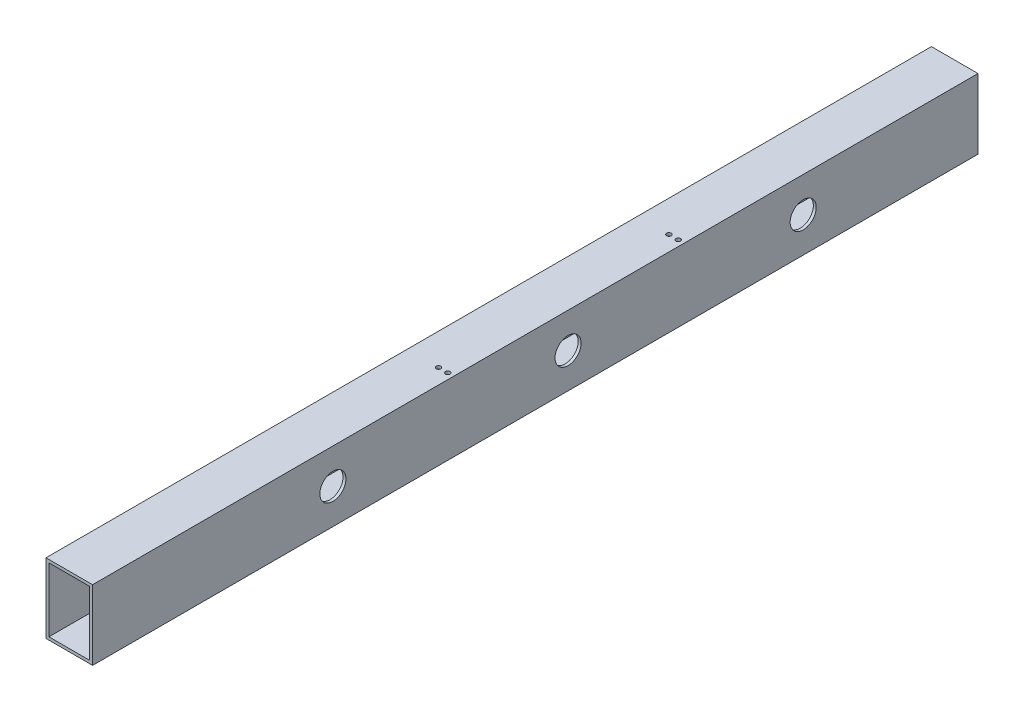
from build123d import *

# Parameters (mm, degrees)
SKETCH1_W           = 50.8
SKETCH1_H           = 76.2
SKETCH1_W_2         = 44.45
SKETCH1_H_2         = 69.85
BOSS_EXTRUDE1_DEPTH = 965.2
CUT_EXTRUDE1_REACH  = 969.287
SKETCH4_R           = 14.224
SKETCH5_R           = 2.50063
CUT_EXTRUDE2_DEPTH  = 3.175


with BuildPart() as part:
    # Sketch1 → Boss-Extrude1 (new body)
    with BuildSketch(Plane.XY):
        Rectangle(SKETCH1_W, SKETCH1_H)
        Rectangle(SKETCH1_W_2, SKETCH1_H_2, mode=Mode.SUBTRACT)
    extrude(amount=BOSS_EXTRUDE1_DEPTH)

    # Cut-Extrude1: up to this face of the body (flat: up to its plane)
    cut_extrude1_end = Plane(part.part.faces().sort_by_distance((-25.4, 0, 482.6))[0])
    # Sketch4 → Cut-Extrude1 (cut, up to the picked face)
    with BuildSketch(Plane(origin=(25.4, 0, 0), x_dir=(0, 0, -1), z_dir=(1, 0, 0)), mode=Mode.PRIVATE) as cut_extrude1_sk1:
        with Locations(Location((-703.246600733, 0, 0), (0, 0, 90))):
            Circle(SKETCH4_R)
    cut_extrude1_tool1 = split(extrude(cut_extrude1_sk1.sketch, amount=-CUT_EXTRUDE1_REACH, mode=Mode.PRIVATE), bisect_by=cut_extrude1_end, keep=Keep.BOTH, mode=Mode.PRIVATE)
    # Sketch4 → Cut-Extrude1 (cut, up to the picked face)
    with BuildSketch(Plane(origin=(25.4, 0, 0), x_dir=(0, 0, -1), z_dir=(1, 0, 0)), mode=Mode.PRIVATE) as cut_extrude1_sk2:
        with Locations(Location((-190.549048411, 0, 0), (0, 0, 90))):
            Circle(SKETCH4_R)
    cut_extrude1_tool2 = split(extrude(cut_extrude1_sk2.sketch, amount=-CUT_EXTRUDE1_REACH, mode=Mode.PRIVATE), bisect_by=cut_extrude1_end, keep=Keep.BOTH, mode=Mode.PRIVATE)
    # Sketch4 → Cut-Extrude1 (cut, up to the picked face)
    with BuildSketch(Plane(origin=(25.4, 0, 0), x_dir=(0, 0, -1), z_dir=(1, 0, 0)), mode=Mode.PRIVATE) as cut_extrude1_sk3:
        with Locations(Location((-446.897824572, 0, 0), (0, 0, 90))):
            Circle(SKETCH4_R)
    cut_extrude1_tool3 = split(extrude(cut_extrude1_sk3.sketch, amount=-CUT_EXTRUDE1_REACH, mode=Mode.PRIVATE), bisect_by=cut_extrude1_end, keep=Keep.BOTH, mode=Mode.PRIVATE)
    add(cut_extrude1_tool1.solids().sort_by(Axis((25.4, 0, 703.246601), (-1, 0, 0)))[0], mode=Mode.SUBTRACT)
    add(cut_extrude1_tool2.solids().sort_by(Axis((25.4, 0, 190.549048), (-1, 0, 0)))[0], mode=Mode.SUBTRACT)
    add(cut_extrude1_tool3.solids().sort_by(Axis((25.4, 0, 446.897825), (-1, 0, 0)))[0], mode=Mode.SUBTRACT)

    # Sketch5 → Cut-Extrude2 (cut)
    with BuildSketch(Plane(origin=(0, 38.1, 0), x_dir=(1, 0, 0), z_dir=(0, 1, 0))):
        with Locations(Location((8.89, -571.614708402, 0), (0, 0, 270))):
            Circle(SKETCH5_R)
        with Locations(Location((19.05, -571.614708402, 0), (0, 0, 270))):
            Circle(SKETCH5_R)
        with Locations((19.05, -320.473808194)):
            Circle(SKETCH5_R)
        with Locations((8.89, -320.473808194)):
            Circle(SKETCH5_R)
    extrude(amount=-CUT_EXTRUDE2_DEPTH, mode=Mode.SUBTRACT)


solid = part.part
